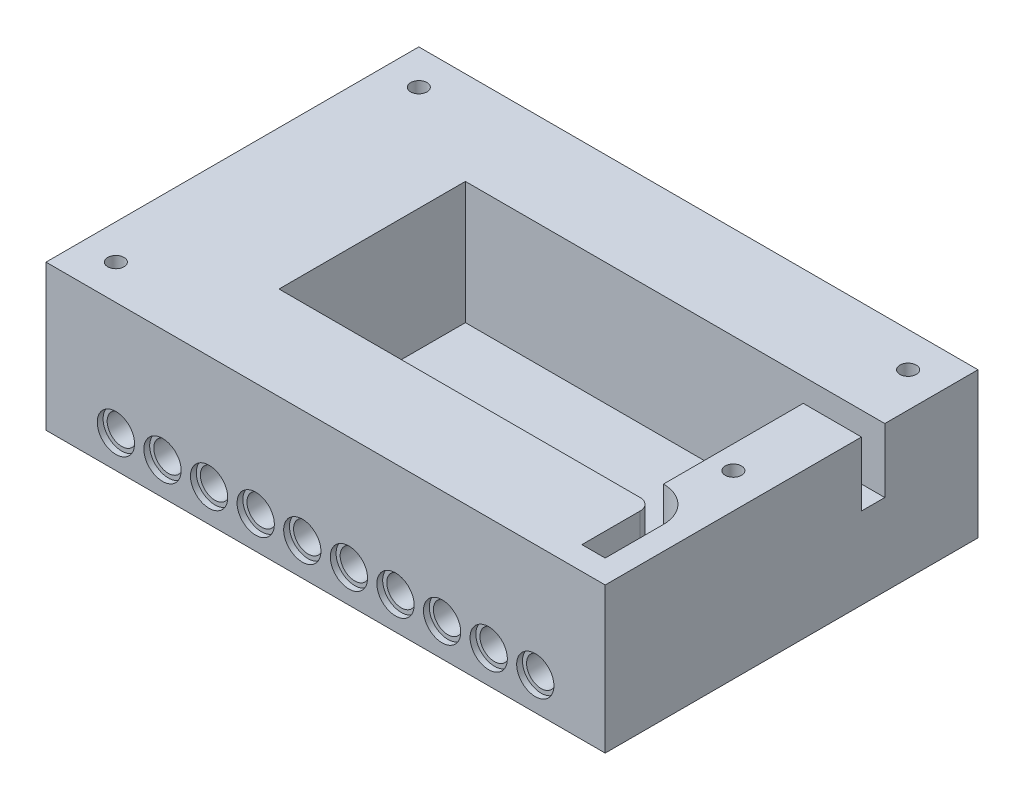
from build123d import *

# Parameters (mm, degrees)
SKETCH1_W           = 96
SKETCH1_H           = 64
BOSS_EXTRUDE1_DEPTH = 4
BOSS_EXTRUDE2_DEPTH = 21
SKETCH3_W           = 10
SKETCH3_H           = 4
BOSS_EXTRUDE4_DEPTH = 10
SKETCH4_R           = 1.4
CUT_EXTRUDE1_DEPTH  = 20
SKETCH5_R           = 2.5
CUT_EXTRUDE2_DEPTH  = 10
SKETCH7_R           = 3.2
CUT_EXTRUDE3_DEPTH  = 1


with BuildPart() as part:
    # Sketch1 → Boss-Extrude1 (new body)
    with BuildSketch(Plane(origin=(0, 0, 0), x_dir=(1, 0, 0), z_dir=(0, 1, 0))):
        Rectangle(SKETCH1_W, SKETCH1_H)
    extrude(amount=BOSS_EXTRUDE1_DEPTH)

    # Sketch2 → Boss-Extrude2 (add)
    with BuildSketch(Plane(origin=(0, 4, 0), x_dir=(1, 0, 0), z_dir=(0, 1, 0))):
        with BuildLine():
            Line((38, 16), (48, 16))
            Line((48, 16), (48, 32))
            Line((48, 32), (-48, 32))
            Line((-48, 32), (-48, -32))
            Line((-48, -32), (48, -32))
            Line((48, -32), (48, 12))
            Line((48, 12), (38, 12))
            Line((38, 12), (38, -12))
            ThreePointArc((38, -12), (42.242640687, -13.757359313), (44, -18))
            Line((44, -18), (44, -28))
            Line((44, -28), (40, -28))
            Line((40, -28), (40, -18))
            ThreePointArc((40, -18), (39.414213562, -16.585786438), (38, -16))
            Line((38, -16), (-24, -16))
            Line((-24, -16), (-24, 16))
            Line((-24, 16), (38, 16))
        make_face()
    extrude(amount=BOSS_EXTRUDE2_DEPTH)

    # Sketch3 → Boss-Extrude4 (add)
    with BuildSketch(Plane(origin=(56, 4, -12), x_dir=(1, 0, 0), z_dir=(0, -1, 0))):
        with Locations((-13, -2)):
            Rectangle(SKETCH3_W, SKETCH3_H)
    extrude(amount=-BOSS_EXTRUDE4_DEPTH)

    # Sketch4 → Cut-Extrude1 (cut)
    with BuildSketch(Plane(origin=(0, 25, 0), x_dir=(1, 0, 0), z_dir=(0, 1, 0))):
        with Locations(Location((-42, 26, 0), (0, 0, 270))):
            Circle(SKETCH4_R)
        with Locations(Location((-42, -26, 0), (0, 0, 90))):
            Circle(SKETCH4_R)
        with Locations(Location((42, 26, 0), (0, 0, 90))):
            Circle(SKETCH4_R)
        with Locations(Location((42, -4, 0), (0, 0, 270))):
            Circle(SKETCH4_R)
    extrude(amount=-CUT_EXTRUDE1_DEPTH, mode=Mode.SUBTRACT)

    # Sketch5 → Cut-Extrude2 (cut)
    with BuildSketch(Plane.XY.offset(32)):
        with Locations((-36, 5.6)):
            Circle(SKETCH5_R)
        with Locations((-28, 5.6)):
            Circle(SKETCH5_R)
        with Locations((-20, 5.6)):
            Circle(SKETCH5_R)
        with Locations((-12, 5.6)):
            Circle(SKETCH5_R)
        with Locations((-4, 5.6)):
            Circle(SKETCH5_R)
        with Locations((4, 5.6)):
            Circle(SKETCH5_R)
        with Locations((12, 5.6)):
            Circle(SKETCH5_R)
        with Locations((20, 5.6)):
            Circle(SKETCH5_R)
        with Locations((28, 5.6)):
            Circle(SKETCH5_R)
        with Locations((36, 5.6)):
            Circle(SKETCH5_R)
    cut_extrude2 = extrude(amount=-CUT_EXTRUDE2_DEPTH, mode=Mode.SUBTRACT)

    # Sketch7 → Cut-Extrude3 (cut)
    with BuildSketch(Plane.XY.offset(32)):
        with Locations((-36, 5.6)):
            Circle(SKETCH7_R)
        with Locations((-28, 5.6)):
            Circle(SKETCH7_R)
        with Locations((-20, 5.6)):
            Circle(SKETCH7_R)
        with Locations((-12, 5.6)):
            Circle(SKETCH7_R)
        with Locations((-4, 5.6)):
            Circle(SKETCH7_R)
        with Locations((4, 5.6)):
            Circle(SKETCH7_R)
        with Locations((12, 5.6)):
            Circle(SKETCH7_R)
        with Locations((20, 5.6)):
            Circle(SKETCH7_R)
        with Locations((28, 5.6)):
            Circle(SKETCH7_R)
        with Locations((36, 5.6)):
            Circle(SKETCH7_R)
    cut_extrude3 = extrude(amount=-CUT_EXTRUDE3_DEPTH, mode=Mode.SUBTRACT)

    # Mirror1: Cut-Extrude2, Cut-Extrude3 across plane
    add(cut_extrude2.mirror(Plane.XY), mode=Mode.SUBTRACT)
    add(cut_extrude3.mirror(Plane.XY), mode=Mode.SUBTRACT)


solid = part.part
